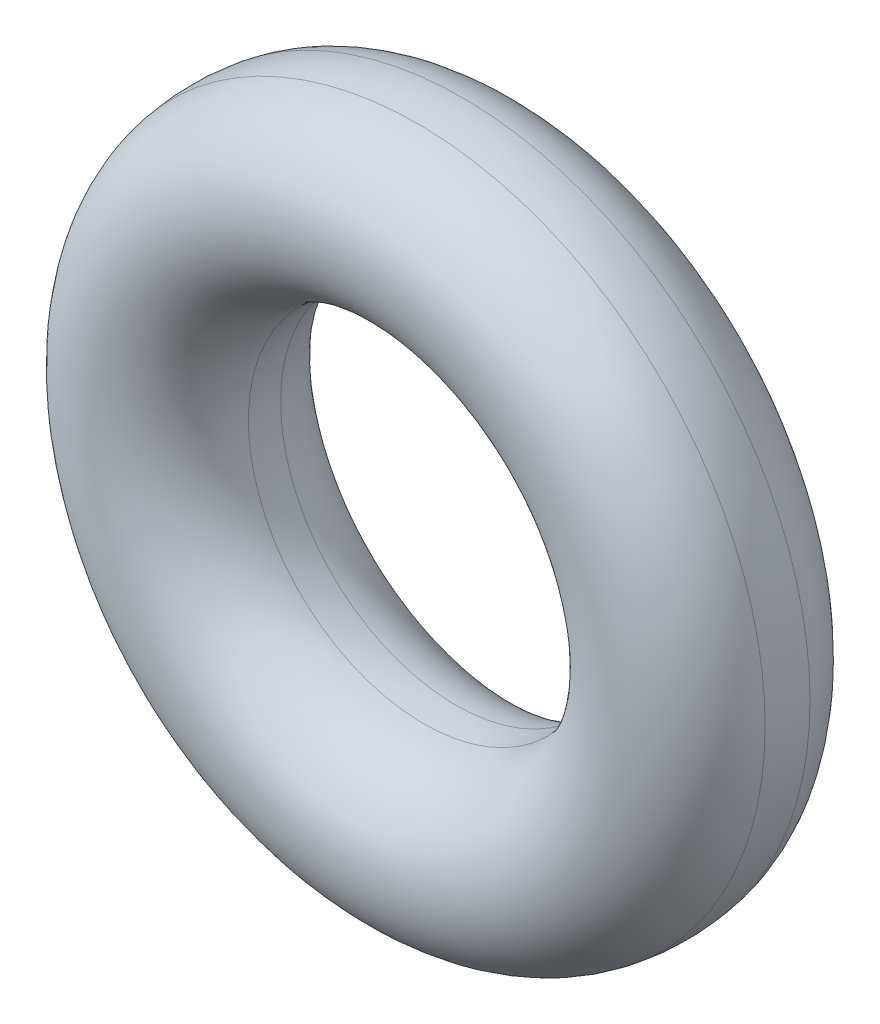
from build123d import *


with BuildPart() as part:
    # Sketch4 → Revolve2 (revolve)
    with BuildSketch(Plane(origin=(0, 0, 0), x_dir=(0, 0, -1), z_dir=(1, 0, 0))):
        with BuildLine():
            ThreePointArc((-6.268969855, 97.005696007), (0, 97.5), (6.268969855, 97.005696007))
            ThreePointArc((6.268969855, 97.005696007), (20.897382604, 88.809162161), (26.7, 73.076925894))
            ThreePointArc((26.7, 73.076925894), (20.303061092, 56.674138111), (4.490198521, 48.932972066))
            ThreePointArc((4.490198521, 48.932972066), (0, 48.745614473), (-4.490198521, 48.932972066))
            ThreePointArc((-4.490198521, 48.932972066), (-20.303061092, 56.674138111), (-26.7, 73.076925894))
            ThreePointArc((-26.7, 73.076925894), (-20.897382604, 88.809162161), (-6.268969855, 97.005696007))
        make_face()
        with BuildLine():
            ThreePointArc((-5.771370373, 93.869931386), (0, 94.325), (5.771370373, 93.869931386))
            ThreePointArc((5.771370373, 93.869931386), (18.482791193, 86.747518806), (23.525, 73.076925894))
            ThreePointArc((23.525, 73.076925894), (17.966353015, 58.82365442), (4.225699536, 52.096935607))
            ThreePointArc((4.225699536, 52.096935607), (0, 51.920614473), (-4.225699536, 52.096935607))
            ThreePointArc((-4.225699536, 52.096935607), (-17.966353015, 58.82365442), (-23.525, 73.076925894))
            ThreePointArc((-23.525, 73.076925894), (-18.482791193, 86.747518806), (-5.771370373, 93.869931386))
        make_face(mode=Mode.SUBTRACT)
    revolve(axis=Axis((0, 0, 66.289038377), (0, 0, -1)))


solid = part.part
